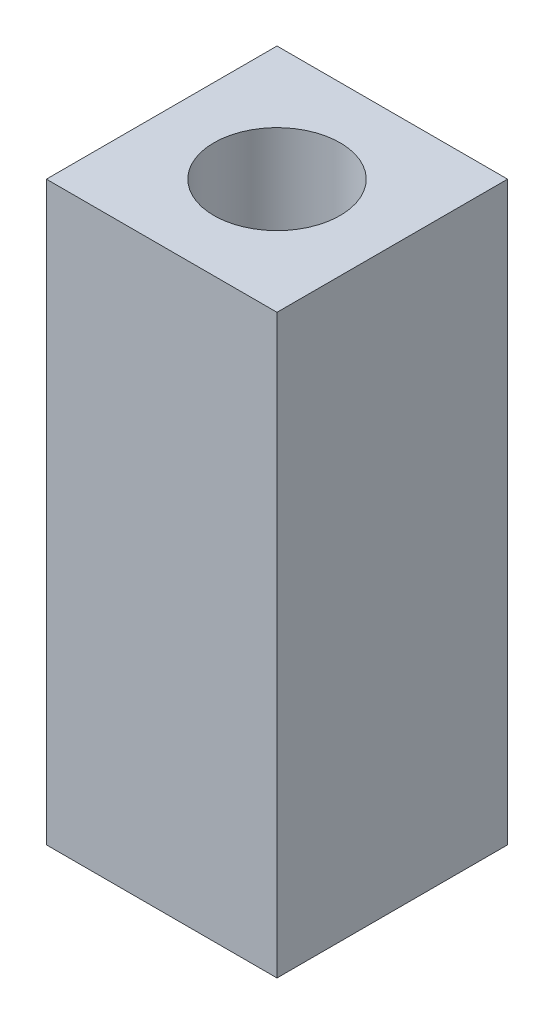
from build123d import *

# Parameters (mm, degrees)
SKETCH_1_W               = 50
SKETCH_1_H               = 50
EXTRUDE_1_DEPTH          = 125
CUT_EXTRUDE_1_REACH      = 138.931
CUT_EXTRUDE_1_END_RADIUS = 13.682408883
SKETCH_4_R               = 2.5


with BuildPart() as part:
    # 草图1 → 凸台-拉伸1 (new body)
    with BuildSketch(Plane(origin=(0, 0, 0), x_dir=(1, 0, 0), z_dir=(0, 1, 0))):
        Rectangle(SKETCH_1_W, SKETCH_1_H)
    extrude(amount=EXTRUDE_1_DEPTH)

    # 草图3 → 切除-旋转1 (revolve, cut)
    with BuildSketch(Plane.XY, mode=Mode.PRIVATE) as cut_revolve_1_sk:
        Polygon((0, 125), (0, 25), (5, 25), (13.682408883, 74.240387651), (13.682408883, 125), align=None)
    revolve(cut_revolve_1_sk.sketch.rotate(Axis((0, 125, 0), (0, -1, 0)), 180), axis=Axis((0, 125, 0), (0, -1, 0)), mode=Mode.SUBTRACT)

    # 切除-拉伸1: up to this cylinder (the profile starts outside it)
    cut_extrude_1_end = Plane(origin=(0, 86.74, 0), z_dir=(0, 1, 0)) * Cylinder(CUT_EXTRUDE_1_END_RADIUS, 306.226817767, mode=Mode.PRIVATE)
    # 草图4 → 切除-拉伸1 (cut, up to the surface)
    with BuildSketch(Plane.ZY.offset(25), mode=Mode.PRIVATE) as cut_extrude_1_sk1:
        with Locations((0, 86.74)):
            Circle(SKETCH_4_R)
    cut_extrude_1_tool1 = extrude(cut_extrude_1_sk1.sketch, amount=-CUT_EXTRUDE_1_REACH, mode=Mode.PRIVATE) - cut_extrude_1_end
    add(cut_extrude_1_tool1.solids().sort_by_distance((-25, 86.74, 0))[0], mode=Mode.SUBTRACT)


solid = part.part
